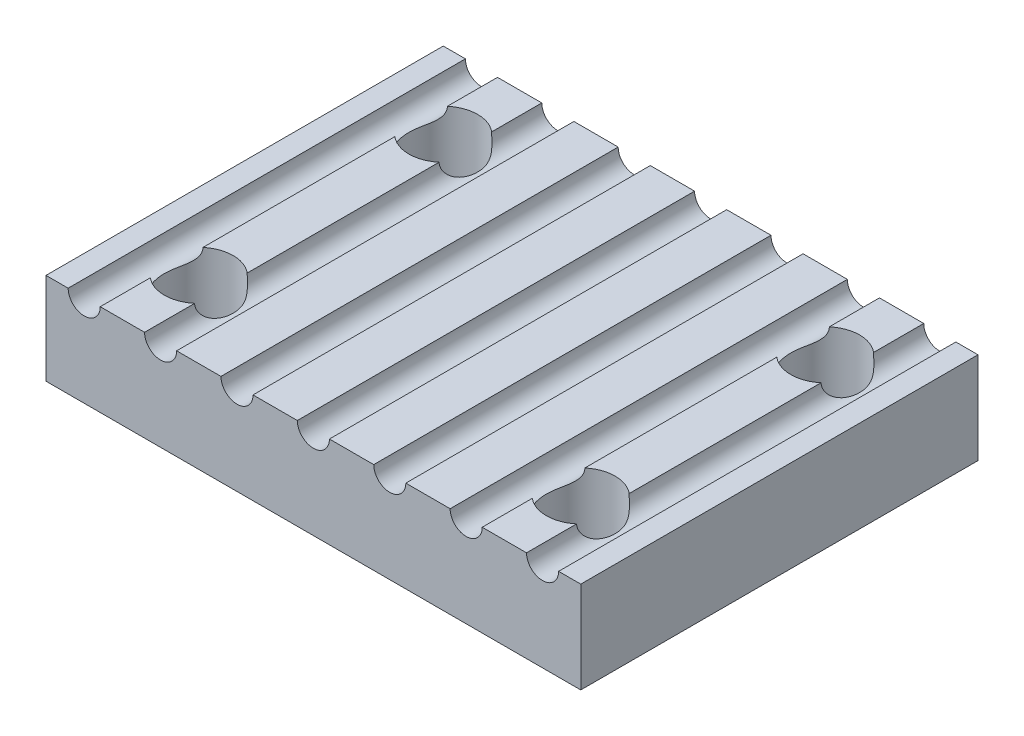
from build123d import *

# Parameters (mm, degrees)
SKETCH_1_W               = 35
SKETCH_1_H               = 26
SKETCH_1_R               = 2.25
EXTRUDE_1_DEPTH          = 6
CUT_EXTRUDE_1_DEPTH      = 23.610838109
CUT_EXTRUDE_1_DEPTH_BACK = 23.610838109
SKETCH_3_R               = 1.05


with BuildPart() as part:
    # 草图1 → 凸台-拉伸1 (new body)
    with BuildSketch(Plane(origin=(0, 0, 0), x_dir=(1, 0, 0), z_dir=(0, 1, 0))):
        Rectangle(SKETCH_1_W, SKETCH_1_H)
        with Locations(Location((-12.5, 8, 0), (0, 0, 270))):
            Circle(SKETCH_1_R, mode=Mode.SUBTRACT)
        with Locations(Location((12.5, 8, 0), (0, 0, 90))):
            Circle(SKETCH_1_R, mode=Mode.SUBTRACT)
        with Locations(Location((-12.5, -8, 0), (0, 0, 90))):
            Circle(SKETCH_1_R, mode=Mode.SUBTRACT)
        with Locations(Location((12.5, -8, 0), (0, 0, 270))):
            Circle(SKETCH_1_R, mode=Mode.SUBTRACT)
    extrude(amount=EXTRUDE_1_DEPTH)

    # 草图3 → 切除-拉伸1 (cut, two sides: drawn at the far end of the back side and taken through both)
    with BuildSketch(Plane.XY.offset(-CUT_EXTRUDE_1_DEPTH_BACK)):
        with Locations((0, 6)):
            Circle(SKETCH_3_R)
        with Locations((5, 6)):
            Circle(SKETCH_3_R)
        with Locations((10, 6)):
            Circle(SKETCH_3_R)
        with Locations((15, 6)):
            Circle(SKETCH_3_R)
        with Locations((-5, 6)):
            Circle(SKETCH_3_R)
        with Locations((-10, 6)):
            Circle(SKETCH_3_R)
        with Locations((-15, 6)):
            Circle(SKETCH_3_R)
    extrude(amount=CUT_EXTRUDE_1_DEPTH + CUT_EXTRUDE_1_DEPTH_BACK, mode=Mode.SUBTRACT)


solid = part.part
